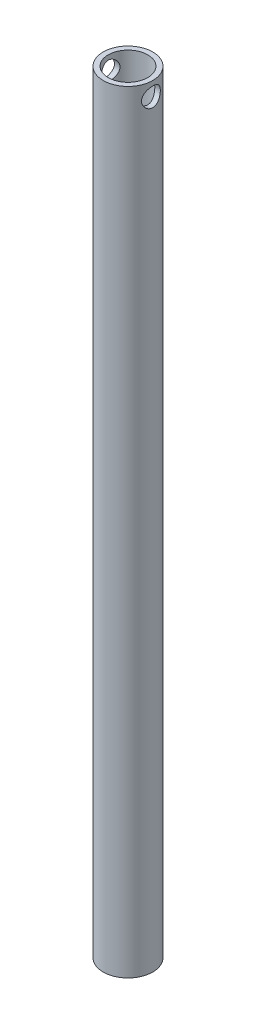
from build123d import *

# Parameters (mm, degrees)
SKETCH1_R               = 16.7005
SKETCH1_R_2             = 13.335
BOSS_EXTRUDE1_DEPTH     = 520.7
CUT_EXTRUDE1_DEPTH      = 522.235362769
CUT_EXTRUDE1_DEPTH_BACK = 522.235362769
SKETCH2_R               = 6.35


with BuildPart() as part:
    # Sketch1 → Boss-Extrude1 (new body)
    with BuildSketch(Plane(origin=(0, 0, 0), x_dir=(1, 0, 0), z_dir=(0, 1, 0))):
        with Locations(Location((0, 0, 0), (0, 0, 270))):
            Circle(SKETCH1_R)
        with Locations(Location((0, 0, 0), (0, 0, 270))):
            Circle(SKETCH1_R_2, mode=Mode.SUBTRACT)
    extrude(amount=BOSS_EXTRUDE1_DEPTH)

    # Sketch2 → Cut-Extrude1 (cut, two sides: drawn at the far end of the back side and taken through both)
    with BuildSketch(Plane(origin=(0, 0, 0), x_dir=(0, 0, -1), z_dir=(1, 0, 0)).offset(-CUT_EXTRUDE1_DEPTH_BACK)):
        with Locations((0, 511.175)):
            Circle(SKETCH2_R)
    extrude(amount=CUT_EXTRUDE1_DEPTH + CUT_EXTRUDE1_DEPTH_BACK, mode=Mode.SUBTRACT)


solid = part.part
